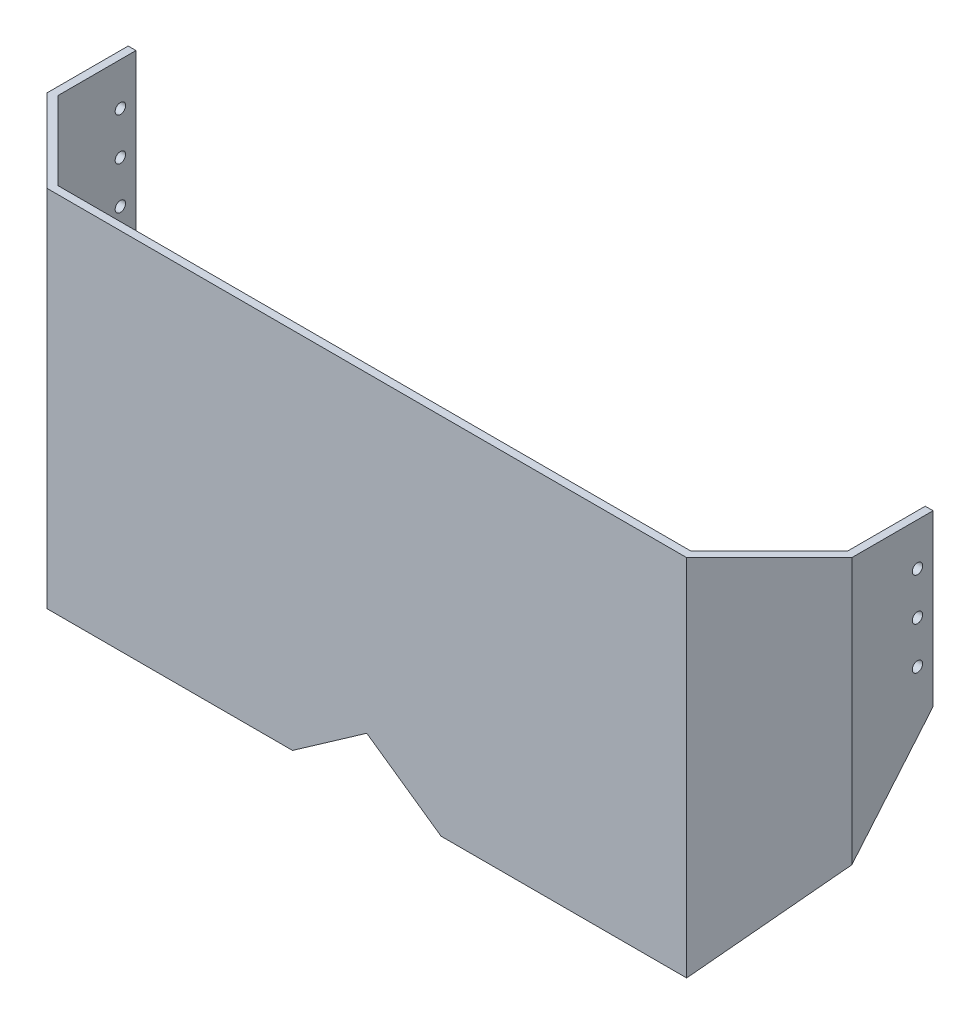
from build123d import *

# Parameters (mm, degrees)
BOSS_EXTRUDE1_DEPTH     = 35
CUT_EXTRUDE1_DEPTH      = 1.5
CUT_EXTRUDE7_DEPTH      = 91.579854792
CUT_EXTRUDE7_DEPTH_BACK = 91.579854792
SKETCH14_R              = 1


with BuildPart() as part:
    # Sketch1 → Boss-Extrude1 (new, symmetric)
    with BuildSketch(Plane(origin=(0, 0, 0), x_dir=(1, 0, 0), z_dir=(0, 1, 0))):
        Polygon((-61.5, 0), (61.5, 0), (77.378679656, 15.878679656), (77.378679656, 31.5), (75.878679656, 31.5), (75.878679656, 16.5), (60.878679656, 1.5), (-60.878679656, 1.5), (-75.878679656, 16.5), (-75.878679656, 31.5), (-77.378679656, 31.5), (-77.378679656, 15.878679656), align=None)
    extrude(amount=BOSS_EXTRUDE1_DEPTH, both=True)

    # Sketch2 → Cut-Extrude1 (cut)
    with BuildSketch(Plane.XY):
        Polygon((0, -25), (-14.281480067, -35), (14.281480067, -35), align=None)
    extrude(amount=-CUT_EXTRUDE1_DEPTH, mode=Mode.SUBTRACT)

    # Sketch12 → Cut-Loft1 section 0
    with BuildSketch(Plane(origin=(29.689339828, 0, 29.689339828), x_dir=(-0.7071067811865465, 0, 0.7071067811865488), z_dir=(-0.7071067811865488, 0, -0.7071067811865465))):
        with BuildLine():
            Line((-44.108387387, -35), (-65.321590822, -17.200008821))
            Line((-65.321590822, -17.200008821), (-65.321590822, -35))
            Line((-65.321590822, -35), (-44.108387387, -35))
        make_face()
    # Sketch7 → Cut-Loft1 section 1
    with BuildSketch(Plane(origin=(30.75, 0, 30.75), x_dir=(0.707106781186546, 0, -0.707106781186549), z_dir=(0.707106781186549, 0, 0.707106781186546))):
        with BuildLine():
            Line((43.487067043, -35), (65.942911166, -16.157309479))
            Line((65.942911166, -16.157309479), (65.942911166, -35))
            Line((65.942911166, -35), (43.487067043, -35))
        make_face()
    cut_loft1 = loft(mode=Mode.SUBTRACT)

    # Sketch8 → Cut-Loft2 section 0
    with BuildSketch(Plane(origin=(77.378679656, 0, 0), x_dir=(0, 0, -1), z_dir=(1, 0, 0))):
        with BuildLine():
            Line((15.878679656, -16.157309479), (31.5, 2.379981476))
            Line((31.5, 2.379981476), (31.5, -35))
            Line((31.5, -35), (15.878679656, -35))
            Line((15.878679656, -35), (15.878679656, -16.157309479))
        make_face()
    # Sketch13 → Cut-Loft2 section 1
    with BuildSketch(Plane.ZY.offset(-75.878679656)):
        with BuildLine():
            Line((-31.5, 0.599982358), (-31.5, -35))
            Line((-31.5, -35), (-16.5, -35))
            Line((-16.5, -35), (-16.5, -17.200008821))
            Line((-16.5, -17.200008821), (-31.5, 0.599982358))
        make_face()
    cut_loft2 = loft(mode=Mode.SUBTRACT)

    # Mirror1: Cut-Loft1, Cut-Loft2 across plane
    add(cut_loft1.mirror(Plane(origin=(0, 0, 0), x_dir=(0, 0, 1), z_dir=(1, 0, 0))), mode=Mode.SUBTRACT)
    add(cut_loft2.mirror(Plane(origin=(0, 0, 0), x_dir=(0, 0, 1), z_dir=(1, 0, 0))), mode=Mode.SUBTRACT)

    # Sketch14 → Cut-Extrude7 (cut, two sides: drawn at the far end of the back side and taken through both)
    with BuildSketch(Plane(origin=(0, 0, 0), x_dir=(0, 0, -1), z_dir=(1, 0, 0)).offset(-CUT_EXTRUDE7_DEPTH_BACK)):
        with Locations((28.5, 26.844995369)):
            Circle(SKETCH14_R)
        with Locations((28.5, 18.689990738)):
            Circle(SKETCH14_R)
        with Locations((28.5, 10.534986107)):
            Circle(SKETCH14_R)
    extrude(amount=CUT_EXTRUDE7_DEPTH + CUT_EXTRUDE7_DEPTH_BACK, mode=Mode.SUBTRACT)


solid = part.part
